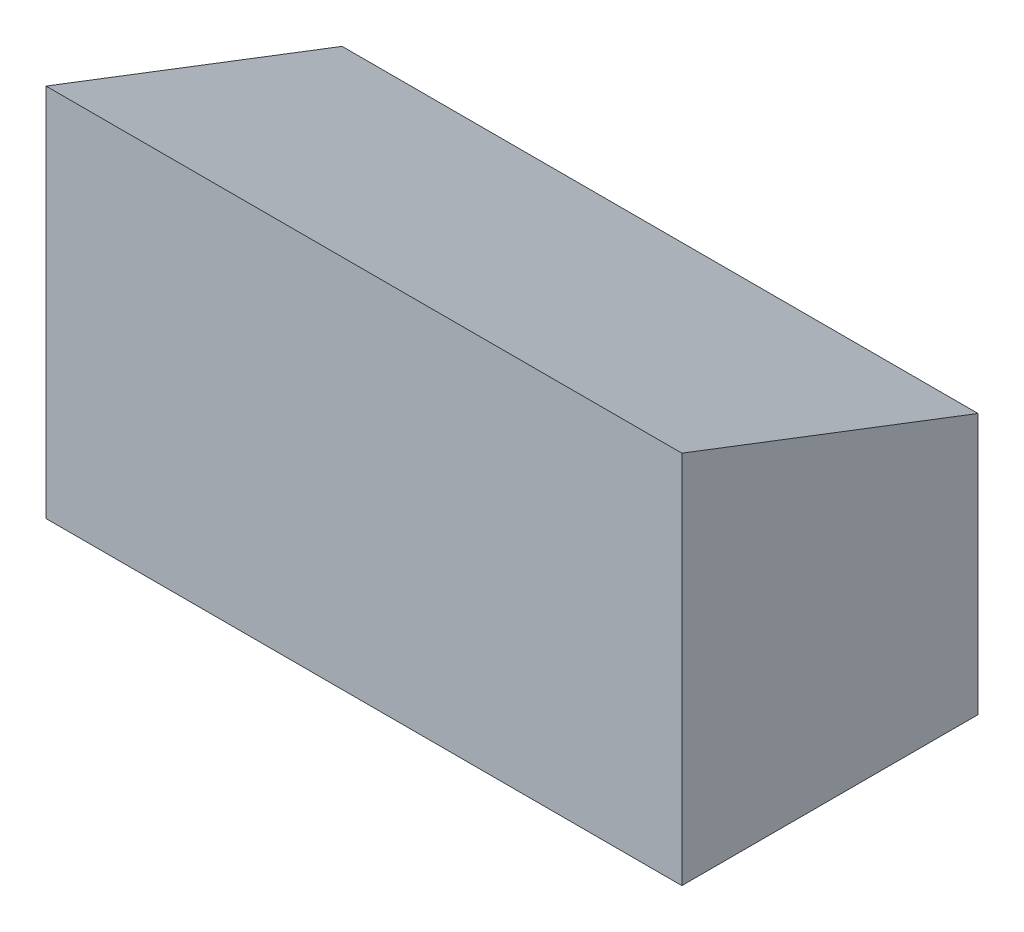
from build123d import *

# Parameters (mm, degrees)
BOSS_EXTRUDE1_DEPTH = 36.5


with BuildPart() as part:
    # Sketch1 → Boss-Extrude1 (new, symmetric)
    with BuildSketch(Plane(origin=(0, 0, 0), x_dir=(0, 0, -1), z_dir=(1, 0, 0))):
        Polygon((0, 0), (0, 29.948622809), (-34, 43), (-34, 0), align=None)
    extrude(amount=BOSS_EXTRUDE1_DEPTH, both=True)


solid = part.part
